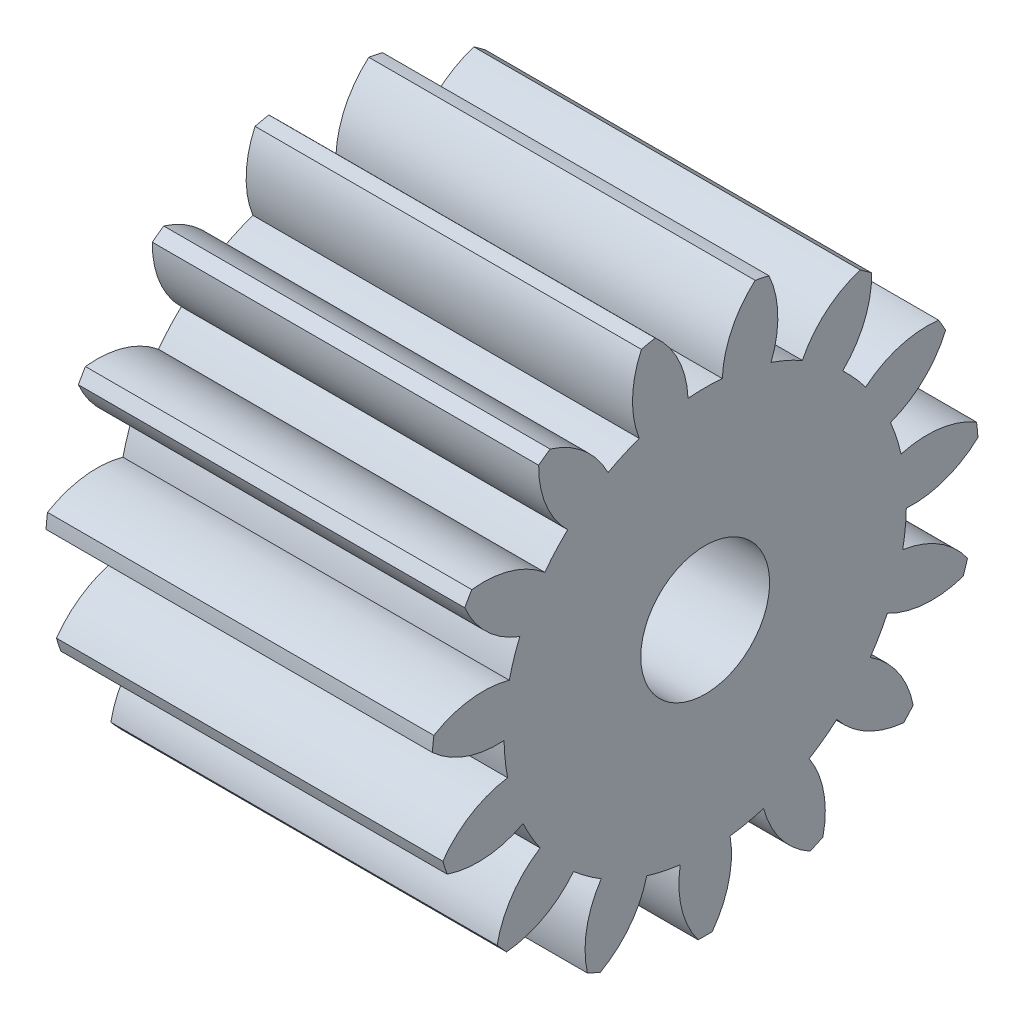
from build123d import *

# Parameters (mm, degrees)
BASPROSKE_W     = 6
BASPROSKE_H     = 4.25
TOOTHCUT_DEPTH  = 9.492643876
TEETHCUTS_COUNT = 15
TEETHCUTS_ANGLE = 336
BORSKE_R        = 1
BORE_DEPTH      = 50.0000508


with BuildPart() as part:
    # BasProSke → Base-Revolve (revolve)
    with BuildSketch(Plane(origin=(0, 0, 0), x_dir=(1, 0, 0), z_dir=(0, 1, 0)), mode=Mode.PRIVATE) as base_revolve_sk:
        with Locations((3, 2.125)):
            Rectangle(BASPROSKE_W, BASPROSKE_H)
    revolve(base_revolve_sk.sketch.rotate(Axis((-10, 0, 0), (1, 0, 0)), 180), axis=Axis((-10, 0, 0), (1, 0, 0)))

    # TooCutSke → ToothCut (cut, through all)
    with BuildSketch(Plane(origin=(0, 0, 0), x_dir=(0, 0, -1), z_dir=(1, 0, 0))):
        with BuildLine():
            ThreePointArc((0.265767165, 3.112674704), (0, 3.124), (-0.265767165, 3.112674704))
            ThreePointArc((-0.265767165, 3.112674704), (-0.418628877, 3.712626775), (-0.800767345, 4.19974009))
            ThreePointArc((-0.800767345, 4.19974009), (0, 4.2754), (0.800767345, 4.19974009))
            ThreePointArc((0.800767345, 4.19974009), (0.418628877, 3.712626775), (0.265767165, 3.112674704))
        make_face()
    toothcut = extrude(amount=TOOTHCUT_DEPTH, mode=Mode.SUBTRACT)

    # TeethCuts: ToothCut ×15 about axis
    teethcuts_axis = Axis((-10, 0, 0), (1, 0, 0))
    for i in range(1, TEETHCUTS_COUNT):
        add(toothcut.rotate(teethcuts_axis, i * TEETHCUTS_ANGLE / (TEETHCUTS_COUNT - 1)), mode=Mode.SUBTRACT)

    # BorSke → Bore (cut, symmetric)
    with BuildSketch(Plane(origin=(0, 0, 0), x_dir=(0, 0, -1), z_dir=(1, 0, 0))):
        with Locations(Location((0, 0, 0), (0, 0, 180))):
            Circle(BORSKE_R)
    extrude(amount=BORE_DEPTH, both=True, mode=Mode.SUBTRACT)


solid = part.part
